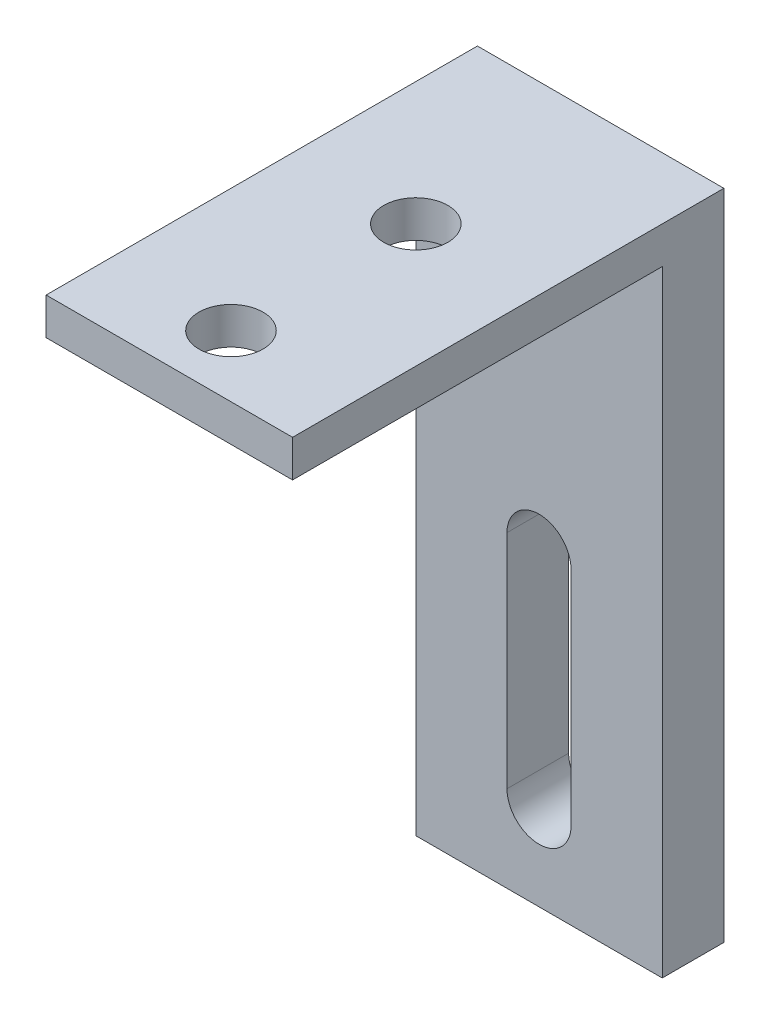
from build123d import *

# Parameters (mm, degrees)
SKETCH1_W           = 20
SKETCH1_H           = 20
SKETCH1_R           = 2.6
BOSS_EXTRUDE2_DEPTH = 3
SKETCH2_W           = 20
SKETCH2_H           = 3
BOSS_EXTRUDE3_DEPTH = 10
SKETCH4_R           = 2.6
CUT_EXTRUDE1_DEPTH  = 10
SKETCH6_W           = 20
SKETCH6_H           = 3
BOSS_EXTRUDE5_DEPTH = 5
SKETCH7_W           = 20
SKETCH7_H           = 5
BOSS_EXTRUDE6_DEPTH = 50
CUT_EXTRUDE2_DEPTH  = 5


with BuildPart() as part:
    # Sketch1 → Boss-Extrude2 (new body)
    with BuildSketch(Plane(origin=(0, 0, 0), x_dir=(1, 0, 0), z_dir=(0, 1, 0))):
        Rectangle(SKETCH1_W, SKETCH1_H)
        with Locations(Location((0, 0, 0), (0, 0, 270))):
            Circle(SKETCH1_R, mode=Mode.SUBTRACT)
    extrude(amount=BOSS_EXTRUDE2_DEPTH)

    # Sketch2 → Boss-Extrude3 (add)
    with BuildSketch(Plane.XY.offset(10)):
        with Locations((0, 1.5)):
            Rectangle(SKETCH2_W, SKETCH2_H)
    extrude(amount=BOSS_EXTRUDE3_DEPTH)

    # Sketch4 → Cut-Extrude1 (cut)
    with BuildSketch(Plane(origin=(0, 3, 0), x_dir=(1, 0, 0), z_dir=(0, 1, 0))):
        with Locations(Location((0, -15, 0), (0, 0, 270))):
            Circle(SKETCH4_R)
    extrude(amount=-CUT_EXTRUDE1_DEPTH, mode=Mode.SUBTRACT)

    # Sketch6 → Boss-Extrude5 (add)
    with BuildSketch(Plane(origin=(0, 0, -10), x_dir=(-1, 0, 0), z_dir=(0, 0, -1))):
        with Locations((0, 1.5)):
            Rectangle(SKETCH6_W, SKETCH6_H)
    extrude(amount=BOSS_EXTRUDE5_DEPTH)

    # Sketch7 → Boss-Extrude6 (add)
    with BuildSketch(Plane.XZ):
        with Locations((0, -12.5)):
            Rectangle(SKETCH7_W, SKETCH7_H)
    extrude(amount=BOSS_EXTRUDE6_DEPTH)

    # Sketch8 → Cut-Extrude2 (cut)
    with BuildSketch(Plane(origin=(0, 0, -15), x_dir=(-1, 0, 0), z_dir=(0, 0, -1))):
        with BuildLine():
            Line((-2.6, -25), (-2.6, -43))
            ThreePointArc((-2.6, -43), (0, -45.6), (2.6, -43))
            Line((2.6, -43), (2.6, -25))
            ThreePointArc((2.6, -25), (0, -22.4), (-2.6, -25))
        make_face()
    extrude(amount=-CUT_EXTRUDE2_DEPTH, mode=Mode.SUBTRACT)


solid = part.part
